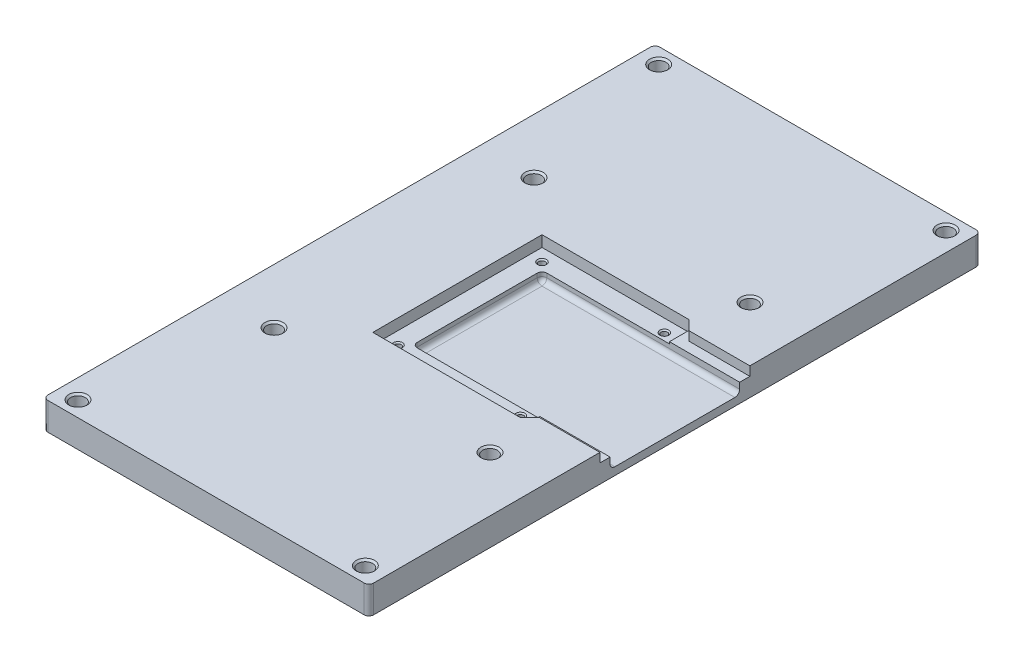
from build123d import *

# Parameters (mm, degrees)
BOSS_EXTRUDE1_DEPTH     = 11.5
SKETCH4_R               = 3.075
CUT_EXTRUDE1_DEPTH      = 6
CUT_EXTRUDE6_DEPTH      = 4.6
CUT_EXTRUDE3_DEPTH      = 145.605932192
CUT_EXTRUDE3_DEPTH_BACK = 3.7
SKETCH24_W              = 82.375
SKETCH24_H              = 54
SKETCH25_R              = 1.35
CUT_EXTRUDE4_DEPTH      = 5
CHAMFER4_SIZE           = 0.5
FILLET1_R               = 2
BOSS_EXTRUDE2_DEPTH     = 0.8
CHAMFER5_SIZE           = 0.75


with BuildPart() as part:
    # Sketch1 → Boss-Extrude1 (new body)
    with BuildSketch(Plane(origin=(0, 0, 0), x_dir=(1, 0, 0), z_dir=(0, 1, 0))):
        with BuildLine():
            Line((-67.875, 112.5), (-67.875, -112.5))
            Line((-67.875, -112.5), (-67.875, -125.5))
            ThreePointArc((-67.875, -125.5), (-67.289213562, -126.914213562), (-65.875, -127.5))
            Line((-65.875, -127.5), (65.875, -127.5))
            ThreePointArc((65.875, -127.5), (67.289213562, -126.914213562), (67.875, -125.5))
            Line((67.875, -125.5), (67.875, -112.5))
            Line((67.875, -112.5), (67.875, 112.5))
            Line((67.875, 112.5), (67.875, 125.5))
            ThreePointArc((67.875, 125.5), (67.289213562, 126.914213562), (65.875, 127.5))
            Line((65.875, 127.5), (-65.875, 127.5))
            ThreePointArc((-65.875, 127.5), (-67.289213562, 126.914213562), (-67.875, 125.5))
            Line((-67.875, 125.5), (-67.875, 112.5))
        make_face()
    extrude(amount=BOSS_EXTRUDE1_DEPTH)

    # Sketch4 → Cut-Extrude1 (cut)
    with BuildSketch(Plane(origin=(0, 11.5, 0), x_dir=(1, 0, 0), z_dir=(0, 1, 0))):
        with Locations(Location((-59.875, -121, 0), (0, 0, 270))):
            Circle(SKETCH4_R)
        with Locations(Location((59.875, -121, 0), (0, 0, 270))):
            Circle(SKETCH4_R)
        with Locations(Location((59.875, 121, 0), (0, 0, 270))):
            Circle(SKETCH4_R)
        with Locations(Location((-59.875, 121, 0), (0, 0, 270))):
            Circle(SKETCH4_R)
        with Locations(Location((45, -54.175, 0), (0, 0, 270))):
            Circle(SKETCH4_R)
        with Locations(Location((-45, -54.175, 0), (0, 0, 270))):
            Circle(SKETCH4_R)
        with Locations(Location((45, 54.175, 0), (0, 0, 270))):
            Circle(SKETCH4_R)
        with Locations(Location((-45, 54.175, 0), (0, 0, 270))):
            Circle(SKETCH4_R)
    extrude(amount=-CUT_EXTRUDE1_DEPTH, mode=Mode.SUBTRACT)

    # Sketch21 → Cut-Extrude6 (cut)
    with BuildSketch(Plane(origin=(0, 11.5, 0), x_dir=(1, 0, 0), z_dir=(0, 1, 0))):
        Polygon((67.875, 31), (67.875, -31), (67.875, -31.25), (42.603553391, -31.25), (38.603553391, -35.25), (-22.75, -35.25), (-22.75, 35.25), (38.603553391, 35.25), (42.603553391, 31.25), (67.875, 31.25), align=None)
    extrude(amount=-CUT_EXTRUDE6_DEPTH, mode=Mode.SUBTRACT)

    # Sketch24 → Cut-Extrude3 (cut, two sides: drawn at the far end of the back side and taken through both)
    with BuildSketch(Plane(origin=(0, 6.9, 0), x_dir=(1, 0, 0), z_dir=(0, 1, 0)).offset(-CUT_EXTRUDE3_DEPTH_BACK)):
        with Locations((26.6875, 0)):
            Rectangle(SKETCH24_W, SKETCH24_H)
    extrude(amount=CUT_EXTRUDE3_DEPTH + CUT_EXTRUDE3_DEPTH_BACK, mode=Mode.SUBTRACT)

    # Sketch25 → Cut-Extrude4 (cut)
    with BuildSketch(Plane(origin=(0, 6.9, 0), x_dir=(1, 0, 0), z_dir=(0, 1, 0))):
        with Locations(Location((33.5, 30, 0), (0, 0, 270))):
            Circle(SKETCH25_R)
        with Locations(Location((-17.5, 30, 0), (0, 0, 270))):
            Circle(SKETCH25_R)
        with Locations(Location((33.5, -30, 0), (0, 0, 270))):
            Circle(SKETCH25_R)
        with Locations(Location((-17.5, -30, 0), (0, 0, 270))):
            Circle(SKETCH25_R)
    extrude(amount=-CUT_EXTRUDE4_DEPTH, mode=Mode.SUBTRACT)

    # Chamfer4
    chamfer4_edges = [part.edges().sort_by_distance(p)[0] for p in [
        (-17.5, 6.9, -31.35),
        (33.5, 6.9, 28.65),
        (-17.5, 6.9, 28.65),
        (33.5, 6.9, -31.35),
    ]]
    chamfer(chamfer4_edges, length=CHAMFER4_SIZE)

    # Fillet1
    fillet1_edges = [part.edges().sort_by_distance(p)[0] for p in [
        (26.6875, 3.2, -27),
        (-14.5, 5.05, -27),
        (-14.5, 3.2, 0),
        (-14.5, 5.05, 27),
        (26.6875, 3.2, 27),
    ]]
    fillet(fillet1_edges, radius=FILLET1_R)

    # Sketch26 → Boss-Extrude2 (add)
    with BuildSketch(Plane(origin=(0, 6.9, 0), x_dir=(1, 0, 0), z_dir=(0, 1, 0))):
        Polygon((38.603553391, 35.25), (38.603553391, 27), (67.875, 27), (67.875, 31.25), (42.603553391, 31.25), align=None)
        Polygon((42.603553391, -31.25), (38.603553391, -35.25), (38.603553391, -27), (67.875, -27), (67.875, -31.25), align=None)
    extrude(amount=BOSS_EXTRUDE2_DEPTH)

    # Chamfer5
    chamfer5_edges = [part.edges().sort_by_distance(p)[0] for p in [
        (59.875, 11.5, 117.925),
        (59.875, 11.5, -124.075),
        (45, 11.5, 51.1),
        (-45, 11.5, 51.1),
        (-45, 11.5, -57.25),
        (45, 11.5, -57.25),
        (-59.875, 11.5, -124.075),
        (-59.875, 11.5, 117.925),
    ]]
    chamfer(chamfer5_edges, length=CHAMFER5_SIZE)


solid = part.part
